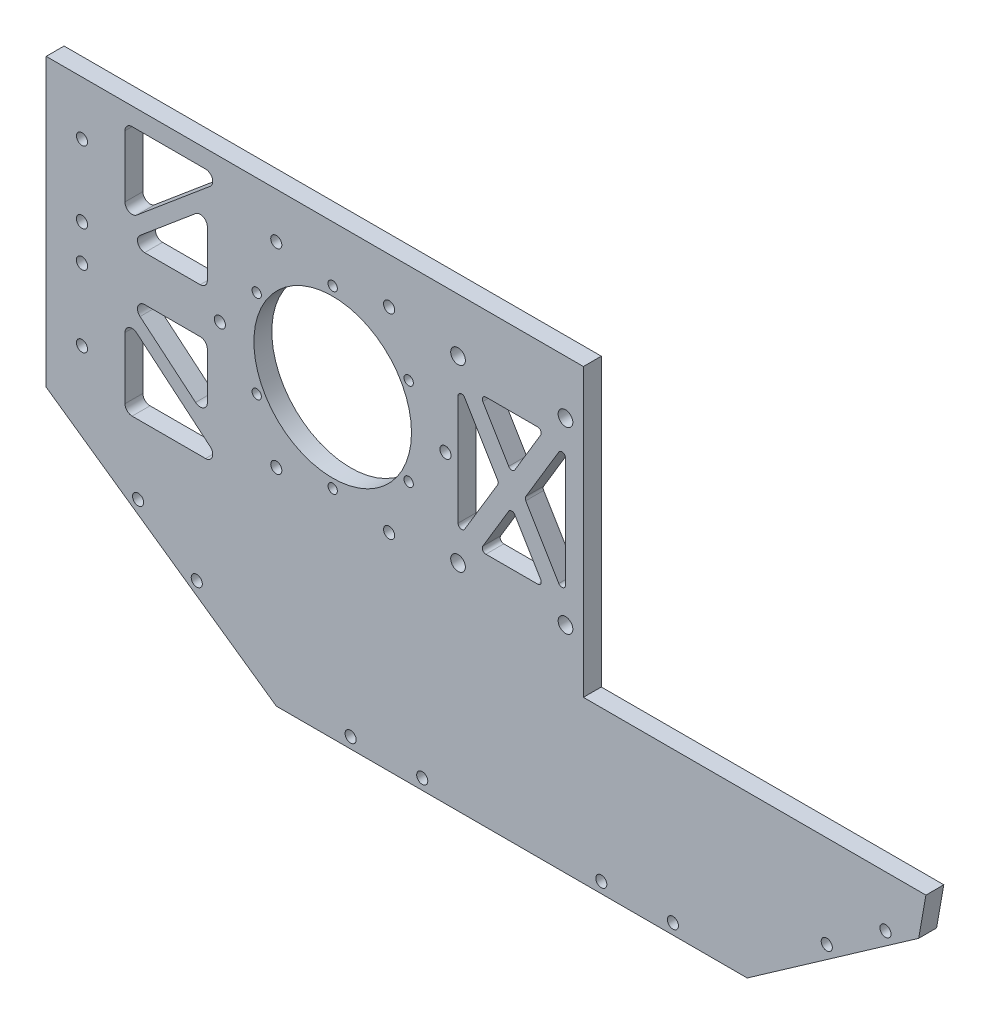
from build123d import *

# Parameters (mm, degrees)
SKETCH_1_W             = 150
SKETCH_1_H             = 80
SKETCH_1_R             = 1.3
SKETCH_1_R_2           = 22
EXTRUDE_1_DEPTH        = 5
SKETCH_3_R             = 1.55
SKETCH_3_R_2           = 1.582849294
CUT_EXTRUDE_3_DEPTH    = 12.5
CUT_EXTRUDE_5_DEPTH    = 8
FILLET_3_R             = 2
FILLET_3_OF_MIRROR_2_R = 2
EXTRUDE_4_DEPTH        = 5
FILLET_5_R             = 5
SKETCH_11_R            = 1.55
CUT_EXTRUDE_7_DEPTH    = 25
SKETCH_12_R            = 2.05
CUT_EXTRUDE_8_DEPTH    = 10
CUT_EXTRUDE_9_DEPTH    = 10
FILLET_6_R             = 1
SKETCH_14_R            = 2.25
CUT_EXTRUDE_10_DEPTH   = 2.5
EXTRUDE_5_DEPTH        = 5
CHAMFER_1_SIZE         = 20
CHAMFER_1_SIZE2        = 14.360300861
SKETCH_16_R            = 1.55
CUT_EXTRUDE_11_DEPTH   = 10.5
CUT_EXTRUDE_START      = -10
CUT_EXTRUDE_12_DEPTH   = 10
SKETCH_18_R            = 1.55
CUT_EXTRUDE_13_DEPTH   = 13


with BuildPart() as part:
    # 草图1 → 凸台-拉伸1 (new body)
    with BuildSketch(Plane.XY):
        with Locations((-5, 0)):
            Rectangle(SKETCH_1_W, SKETCH_1_H)
        with Locations((0, -24.5)):
            Circle(SKETCH_1_R, mode=Mode.SUBTRACT)
        with Locations((-21.217622393, -12.25)):
            Circle(SKETCH_1_R, mode=Mode.SUBTRACT)
        with Locations((-21.217622393, 12.25)):
            Circle(SKETCH_1_R, mode=Mode.SUBTRACT)
        Circle(SKETCH_1_R_2, mode=Mode.SUBTRACT)
        with Locations((0, 24.5)):
            Circle(SKETCH_1_R, mode=Mode.SUBTRACT)
        with Locations((21.217622393, 12.25)):
            Circle(SKETCH_1_R, mode=Mode.SUBTRACT)
        with Locations((21.217622393, -12.25)):
            Circle(SKETCH_1_R, mode=Mode.SUBTRACT)
    extrude(amount=EXTRUDE_1_DEPTH)

    # 草图3 → 切除-拉伸3 (cut)
    with BuildSketch(Plane.XY.offset(5)):
        with Locations((-70, -25)):
            Circle(SKETCH_3_R)
        with Locations((-70, -5)):
            Circle(SKETCH_3_R_2)
        with Locations((-70, 25)):
            Circle(SKETCH_3_R)
        with Locations((-70, 5)):
            Circle(SKETCH_3_R_2)
    extrude(amount=-CUT_EXTRUDE_3_DEPTH, mode=Mode.SUBTRACT)

    # 草图4 → 切除-拉伸5 (cut)
    with BuildSketch(Plane.XY.offset(5)):
        Polygon((-58, 35), (-30, 35), (-58, 11.505210327), align=None)
        Polygon((-35, 25.582872687), (-58, 6.28358117), (-35, 6.28358117), align=None)
    cut_extrude_5 = extrude(amount=-CUT_EXTRUDE_5_DEPTH, mode=Mode.SUBTRACT)

    # 圆角3
    fillet_3_edges = [part.edges().sort_by_distance(p)[0] for p in [
        (-35, 6.28358117, 2.5),
        (-58, 6.28358117, 2.5),
        (-35, 25.582872687, 2.5),
        (-30, 35, 2.5),
        (-58, 11.505210327, 2.5),
        (-58, 35, 2.5),
    ]]
    fillet(fillet_3_edges, radius=FILLET_3_R)

    # 镜向2: 切除-拉伸5 across plane
    add(cut_extrude_5.mirror(Plane.ZX), mode=Mode.SUBTRACT)

    # 圆角3 of 镜向2
    fillet_3_of_mirror_2_edges = [part.edges().sort_by_distance(p)[0] for p in [
        (-35, -6.28358117, 2.5),
        (-58, -6.28358117, 2.5),
        (-35, -25.582872687, 2.5),
        (-30, -35, 2.5),
        (-58, -11.505210327, 2.5),
        (-58, -35, 2.5),
    ]]
    fillet(fillet_3_of_mirror_2_edges, radius=FILLET_3_OF_MIRROR_2_R)

    # 草图10 → 凸台-拉伸4 (add)
    with BuildSketch(Plane.XY.offset(5)):
        Polygon((-80, -40), (-127.053079228, -7.053079228), (-80, 40), align=None)
    extrude(amount=-EXTRUDE_4_DEPTH)

    # 圆角5
    fillet_5_edges = [part.edges().sort_by_distance(p)[0] for p in [
        (-127.053079228, -7.053079228, 2.5),
    ]]
    fillet(fillet_5_edges, radius=FILLET_5_R)

    # 草图11 → 切除-拉伸7 (cut)
    with BuildSketch(Plane.XY.offset(5)):
        with Locations((-15.75, 27.279800219)):
            Circle(SKETCH_11_R)
        with Locations((15.75, 27.279800219)):
            Circle(SKETCH_11_R)
        with Locations((31.5, 0)):
            Circle(SKETCH_11_R)
        with Locations((15.75, -27.279800219)):
            Circle(SKETCH_11_R)
        with Locations((-15.75, -27.279800219)):
            Circle(SKETCH_11_R)
        with Locations((-31.5, 0)):
            Circle(SKETCH_11_R)
    extrude(amount=-CUT_EXTRUDE_7_DEPTH, mode=Mode.SUBTRACT)

    # 草图12 → 切除-拉伸8 (cut)
    with BuildSketch(Plane.XY.offset(5)):
        with Locations((35, 25)):
            Circle(SKETCH_12_R)
        with Locations((65, 25)):
            Circle(SKETCH_12_R)
        with Locations((65, -25)):
            Circle(SKETCH_12_R)
        with Locations((35, -25)):
            Circle(SKETCH_12_R)
    extrude(amount=-CUT_EXTRUDE_8_DEPTH, mode=Mode.SUBTRACT)

    # 草图13 → 切除-拉伸9 (cut)
    with BuildSketch(Plane.XY.offset(5)):
        Polygon((35, 19), (35, -19), (46.4, 0), align=None)
        Polygon((65, -19), (53.6, 0), (65, 19), align=None)
        Polygon((41, 19), (50, 4), (59, 19), align=None)
        Polygon((50, -4), (59, -19), (41, -19), align=None)
    extrude(amount=-CUT_EXTRUDE_9_DEPTH, mode=Mode.SUBTRACT)

    # 圆角6
    fillet_6_edges = [part.edges().sort_by_distance(p)[0] for p in [
        (41, 19, 2.5),
        (59, 19, 2.5),
        (50, 4, 2.5),
        (65, 19, 2.5),
        (65, -19, 2.5),
        (53.6, 0, 2.5),
        (41, -19, 2.5),
        (50, -4, 2.5),
        (59, -19, 2.5),
        (35, 19, 2.5),
        (46.4, 0, 2.5),
        (35, -19, 2.5),
    ]]
    fillet(fillet_6_edges, radius=FILLET_6_R)

    # 草图14 → 切除-拉伸10 (cut)
    with BuildSketch(Plane(origin=(0, 0, 0), x_dir=(-1, 0, 0), z_dir=(0, 0, -1))):
        with Locations((0, 24.5)):
            Circle(SKETCH_14_R)
        with Locations((21.217622393, 12.25)):
            Circle(SKETCH_14_R)
        with Locations((21.217622393, -12.25)):
            Circle(SKETCH_14_R)
        with Locations((0, -24.5)):
            Circle(SKETCH_14_R)
        with Locations((-21.217622393, -12.25)):
            Circle(SKETCH_14_R)
        with Locations((-21.217622393, 12.25)):
            Circle(SKETCH_14_R)
    extrude(amount=-CUT_EXTRUDE_10_DEPTH, mode=Mode.SUBTRACT)

    # 草图15 → 凸台-拉伸5 (add)
    with BuildSketch(Plane(origin=(0, 0, 0), x_dir=(-1, 0, 0), z_dir=(0, 0, -1))):
        Polygon((15.733339697, -85), (80, -40), (-50, -40), (-50, -85), align=None)
        Polygon((-50, -85), (-50, -40), (-180, -40), (-115.733339697, -85), align=None)
    extrude(amount=-EXTRUDE_5_DEPTH)

    # 倒角1
    chamfer_1_edges = [part.edges().sort_by_distance(p)[0] for p in [
        (180, -40, 2.5),
    ]]
    chamfer_1_side = [part.faces().sort_by_distance(p)[0] for p in [
        (147.866669848, -62.5, 2.5),
    ]]
    chamfer(chamfer_1_edges, length=CHAMFER_1_SIZE, length2=CHAMFER_1_SIZE2, reference=chamfer_1_side[0])

    # 草图16 → 切除-拉伸11 (cut)
    with BuildSketch(Plane(origin=(0, 0, 0), x_dir=(-1, 0, 0), z_dir=(0, 0, -1))):
        with Locations((-95, -82)):
            Circle(SKETCH_16_R)
        with Locations((-75, -82)):
            Circle(SKETCH_16_R)
        with Locations((-25, -82)):
            Circle(SKETCH_16_R)
        with Locations((-5, -82)):
            Circle(SKETCH_16_R)
    extrude(amount=-CUT_EXTRUDE_11_DEPTH, mode=Mode.SUBTRACT)

    # 草图17 → 切除-拉伸12 (cut)
    with BuildSketch(Plane.XY.offset(5).offset(CUT_EXTRUDE_START)):
        with BuildLine():
            Line((-80, 40), (-122.839593994, -2.839593994))
            ThreePointArc((-122.839593994, -2.839593994), (-124.285033579, -6.810906614), (-122.17194227, -10.470888122))
            Line((-122.17194227, -10.470888122), (-80, -40))
            Line((-80, -40), (-80, 0))
            Line((-80, 0), (-80, 40))
        make_face()
    extrude(amount=CUT_EXTRUDE_12_DEPTH, mode=Mode.SUBTRACT)

    # 草图18 → 切除-拉伸13 (cut)
    with BuildSketch(Plane.XY.offset(5)):
        with Locations((-54.337460982, -54.306779504)):
            Circle(SKETCH_18_R)
        with Locations((-37.954420096, -65.778308231)):
            Circle(SKETCH_18_R)
        with Locations((137.954420096, -65.778308231)):
            Circle(SKETCH_18_R)
        with Locations((154.337460982, -54.306779504)):
            Circle(SKETCH_18_R)
    extrude(amount=-CUT_EXTRUDE_13_DEPTH, mode=Mode.SUBTRACT)


solid = part.part
